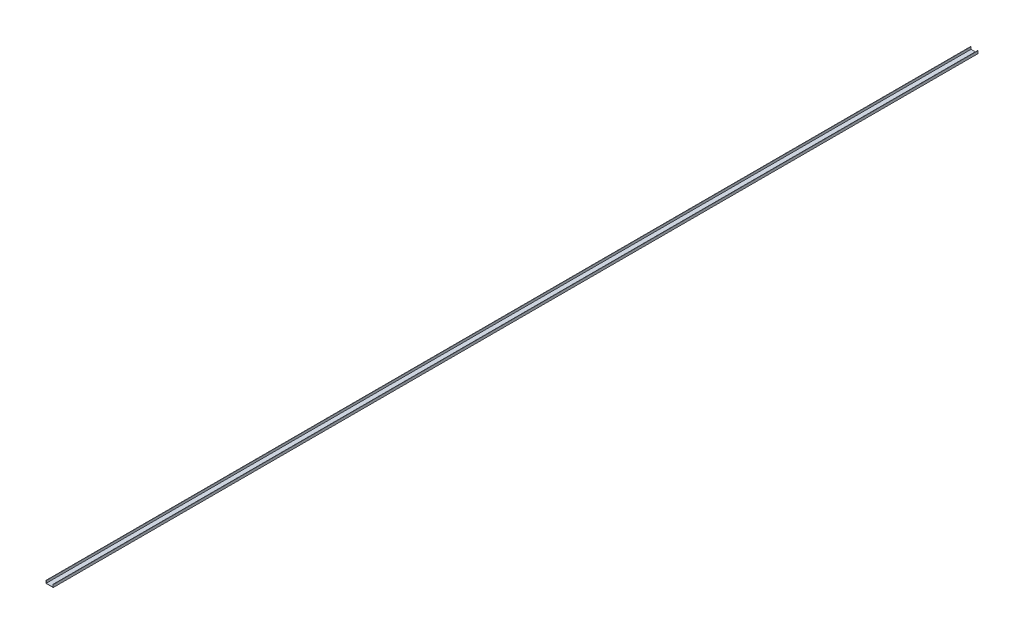
from build123d import *

# Parameters (mm, degrees)
EXTRUDE_1_DEPTH = 3460


with BuildPart() as part:
    # 草图1 → 凸台-拉伸1 (new body)
    with BuildSketch(Plane.XY):
        Polygon((0, 10), (0, 0), (27, 0), (27, 10), (26, 10), (26, 1), (1, 1), (1, 10), align=None)
    extrude(amount=EXTRUDE_1_DEPTH)


solid = part.part
